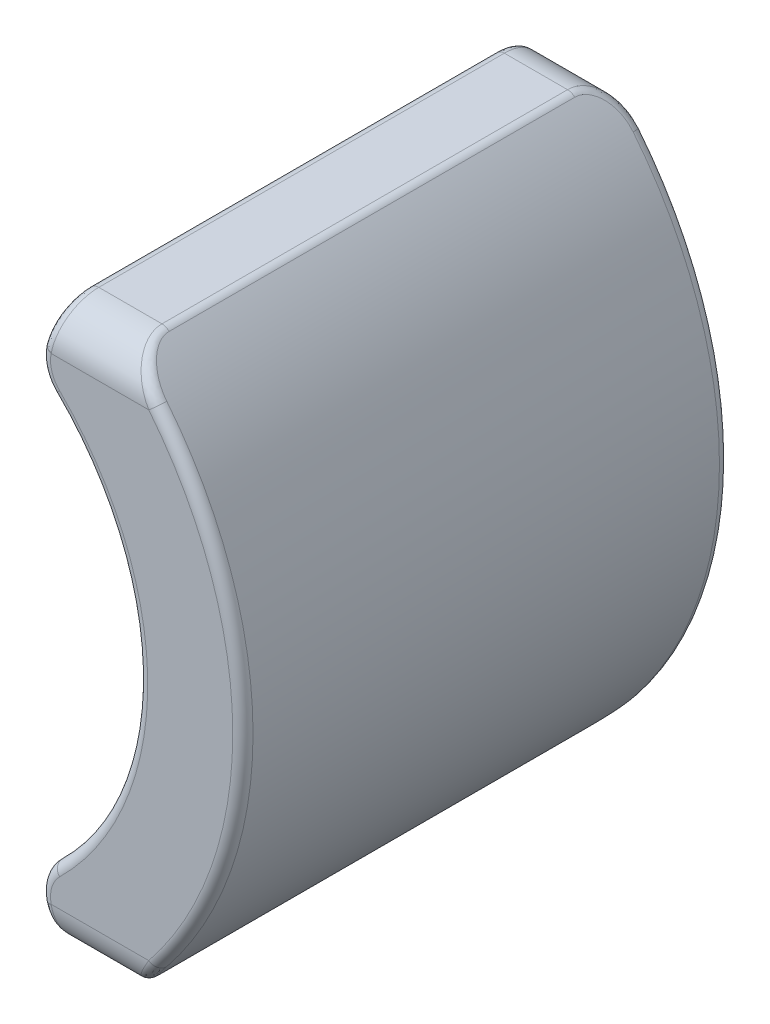
from build123d import *

# Parameters (mm, degrees)
BOSS_EXTRUDE1_DEPTH = 12
FILLET1_R           = 1
FILLET2_R           = 1
FILLET3_R           = 0.25
SCALE1_SCALE        = 0.445


with BuildPart() as part:
    # Sketch1 → Boss-Extrude1 (new body)
    with BuildSketch(Plane.XY):
        with BuildLine():
            Line((6.738137725, -6.88), (4.878137725, -6.88))
            Line((4.878137725, -6.88), (4.531835438, -5.38))
            ThreePointArc((4.531835438, -5.38), (7.034339517, 0), (4.531835438, 5.38))
            Line((4.531835438, 5.38), (4.878137725, 6.88))
            Line((4.878137725, 6.88), (6.738137725, 6.88))
            ThreePointArc((6.738137725, 6.88), (9.63, 0), (6.738137725, -6.88))
        make_face()
    extrude(amount=BOSS_EXTRUDE1_DEPTH)

    # Fillet1
    fillet1_edges = [part.edges().sort_by_distance(p)[0] for p in [
        (4.531835438, -5.38, 6),
        (4.531835438, 5.38, 6),
    ]]
    fillet(fillet1_edges, radius=FILLET1_R)

    # Fillet2
    fillet2_edges = [part.edges().sort_by_distance(p)[0] for p in [
        (5.808137725, -6.88, 12),
        (5.808137725, -6.88, 0),
        (5.808137725, 6.88, 12),
        (5.808137725, 6.88, 0),
    ]]
    fillet(fillet2_edges, radius=FILLET2_R)

    # Fillet3
    fillet3_edges = [part.edges().sort_by_distance(p)[0] for p in [
        (7.034339517, 0, 0),
        (4.687877266, 5.411310183, 0),
        (7.034339517, 0, 12),
        (4.687877266, -5.411310183, 12),
        (9.63, 0, 12),
        (4.687877266, 5.411310183, 12),
        (9.63, 0, 0),
        (6.738137725, 6.88, 6),
        (6.738137725, -6.88, 6),
        (7.064336577, 6.544619807, 0.2528183),
        (7.064336577, 6.544619807, 11.7471817),
        (7.064336577, -6.544619807, 0.2528183),
        (7.064336589, -6.544619821, 11.747181705),
        (4.878137725, -6.88, 6),
        (4.815123489, -6.607055355, 0.313421155),
        (4.815123489, -6.607055355, 11.686578845),
        (4.687877266, -5.411310183, 0),
        (4.655934772, -5.914769545, 0.000604643),
        (4.655934772, -5.914769545, 11.999395357),
        (4.655934776, 5.914769544, 0.00060465),
        (4.655934776, 5.914769544, 11.99939535),
        (4.878137725, 6.88, 6),
        (4.815123489, 6.607055355, 0.313421155),
        (4.815123489, 6.607055355, 11.686578845),
    ]]
    fillet(fillet3_edges, radius=FILLET3_R)


with BuildPart() as part_1:
    # Scale1: scaled about (7.322759703, 3.2e-08, 5.999999972)
    add(part.part.scale(SCALE1_SCALE).moved(Location((4.064131635, 1.8e-08, 3.329999984))))


solid = part_1.part
